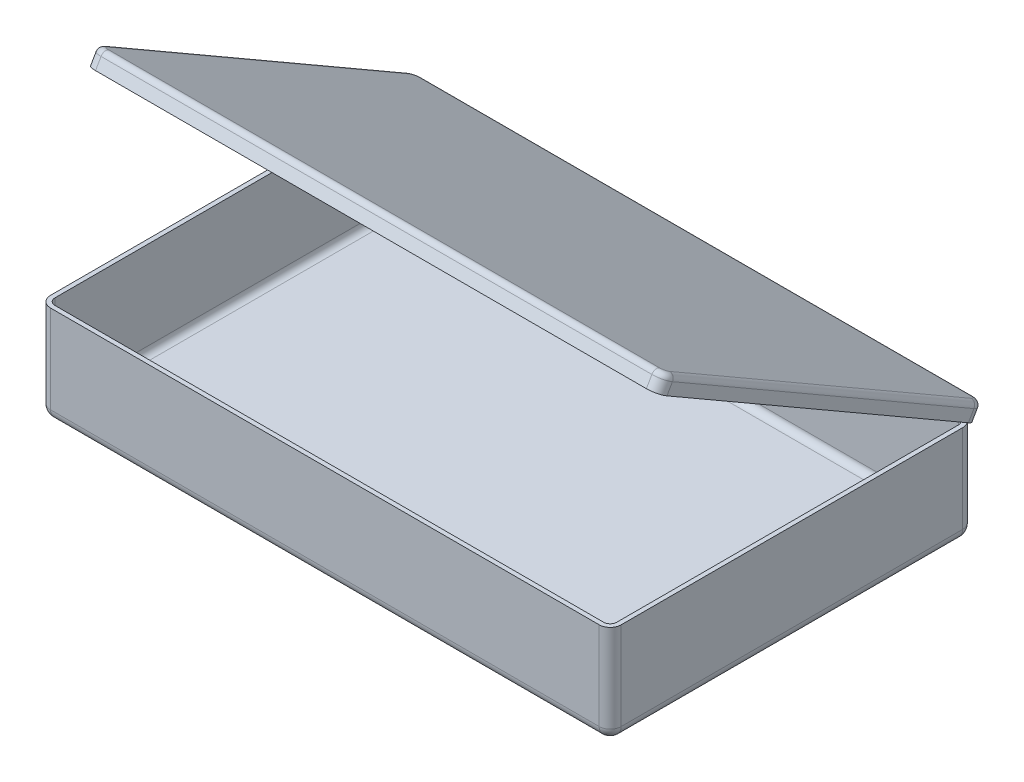
from build123d import *

# Parameters (mm, degrees)
SKETCH1_W                       = 328.93
SKETCH1_H                       = 209.55
BOSS_EXTRUDE1_DEPTH             = 57.15
FILLET1_R                       = 6.35
SHELL1_T                        = -2.54
LID_OPENING_ANGLE_CONTROL_DEPTH = 165.1
FILLET2_R                       = 6.35
FILLET3_R                       = 3.175
SHELL2_T                        = -2.54


with BuildPart() as part:
    # Sketch1 → Boss-Extrude1 (new body)
    with BuildSketch(Plane(origin=(0, 0, 0), x_dir=(1, 0, 0), z_dir=(0, 1, 0))):
        Rectangle(SKETCH1_W, SKETCH1_H)
    extrude(amount=BOSS_EXTRUDE1_DEPTH)

    # Fillet1
    fillet1_edges = [part.edges().sort_by_distance(p)[0] for p in [
        (0, 0, 104.775),
        (-164.465, 0, 0),
        (0, 0, -104.775),
        (164.465, 0, 0),
        (164.465, 28.575, 104.775),
        (-164.465, 28.575, 104.775),
        (-164.465, 28.575, -104.775),
        (164.465, 28.575, -104.775),
    ]]
    fillet(fillet1_edges, radius=FILLET1_R)

    # Shell1
    shell1_openings = [part.faces().sort_by_distance(p)[0] for p in [
        (0, 57.15, 0),
    ]]
    offset(amount=SHELL1_T, openings=shell1_openings, kind=Kind.INTERSECTION)


with BuildPart() as body_2:
    # Sketch2 → LID OPENING ANGLE CONTROL (new, symmetric)
    with BuildSketch(Plane(origin=(0, 0, 0), x_dir=(0, 0, -1), z_dir=(1, 0, 0))):
        Polygon((106.571051224, 55.353948776), (-78.204128927, 162.033948776), (-73.441628927, 170.282840747), (111.333551224, 63.602840747), align=None)
    extrude(amount=LID_OPENING_ANGLE_CONTROL_DEPTH, both=True)

    # Fillet2
    fillet2_edges = [body_2.edges().sort_by_distance(p)[0] for p in [
        (165.1, 166.158394761, 75.822878927),
        (165.1, 59.478394761, -108.952301224),
        (-165.1, 166.158394761, 75.822878927),
        (-165.1, 59.478394761, -108.952301224),
    ]]
    fillet(fillet2_edges, radius=FILLET2_R)

    # Fillet3
    fillet3_edges = [body_2.edges().sort_by_distance(p)[0] for p in [
        (165.1, 116.942840747, -18.945961148),
        (-165.1, 116.942840747, -18.945961148),
        (0, 170.282840747, 73.441628927),
        (0, 63.602840747, -111.333551224),
        (-163.240128061, 169.352904777, 71.83093258),
        (163.240128061, 169.352904777, 71.83093258),
        (-163.240128061, 64.532776717, -109.722854877),
        (163.240128061, 64.532776717, -109.722854877),
    ]]
    fillet(fillet3_edges, radius=FILLET3_R)

    # Shell2
    shell2_openings = [body_2.faces().sort_by_distance(p)[0] for p in [
        (0, 108.693948776, -14.183461148),
    ]]
    offset(amount=SHELL2_T, openings=shell2_openings, kind=Kind.INTERSECTION)


solid = Compound([part.part, body_2.part])
